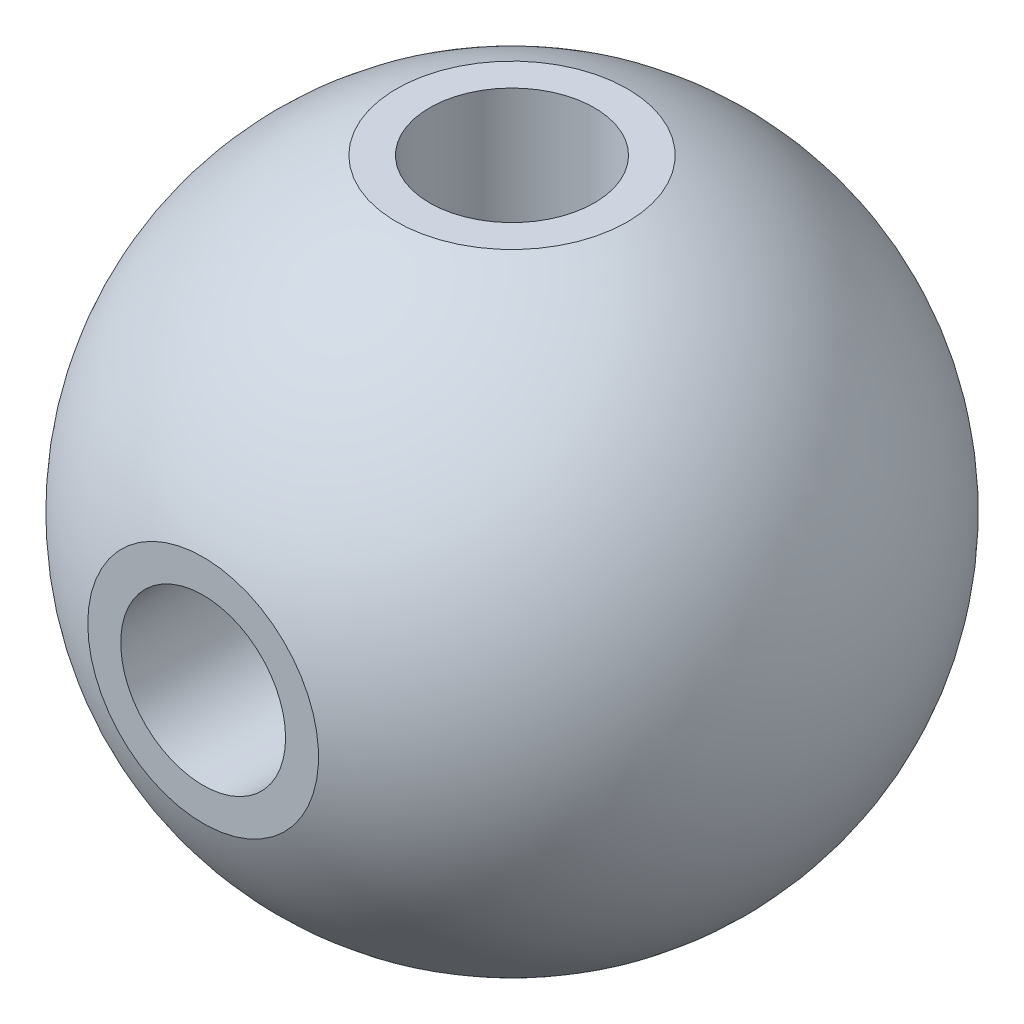
from build123d import *

# Parameters (mm, degrees)
CUT_EXTRUDE1_START = 11.896721
SKETCH3_R          = 4.445
CUT_EXTRUDE1_DEPTH = 2.54
SKETCH4_R          = 3.175
CUT_EXTRUDE2_DEPTH = 7.62
CUT_EXTRUDE3_START = 11.896721
SKETCH5_R          = 4.445
CUT_EXTRUDE3_DEPTH = 7.62
SKETCH6_R          = 3.175
CUT_EXTRUDE4_DEPTH = 7.62


with BuildPart() as part:
    # Sketch2 → Revolve2 (revolve)
    with BuildSketch(Plane.XY):
        with BuildLine():
            Line((0, 12.7), (0, -12.7))
            ThreePointArc((0, -12.7), (12.7, 0), (0, 12.7))
        make_face()
    revolve(axis=Axis((0, 0, 0), (0, 1, 0)))

    # Sketch3 → Cut-Extrude1 (cut)
    with BuildSketch(Plane.XY.offset(CUT_EXTRUDE1_START)):
        Circle(SKETCH3_R)
    cut_extrude1 = extrude(amount=CUT_EXTRUDE1_DEPTH, mode=Mode.SUBTRACT)

    # Sketch4 → Cut-Extrude2 (cut)
    with BuildSketch(Plane.XY.offset(11.896721187)):
        Circle(SKETCH4_R)
    cut_extrude2 = extrude(amount=-CUT_EXTRUDE2_DEPTH, mode=Mode.SUBTRACT)

    # Mirror1: Cut-Extrude1, Cut-Extrude2 across plane
    add(cut_extrude1.mirror(Plane.XY), mode=Mode.SUBTRACT)
    add(cut_extrude2.mirror(Plane.XY), mode=Mode.SUBTRACT)

    # Sketch5 → Cut-Extrude3 (cut)
    with BuildSketch(Plane(origin=(0, 0, 0), x_dir=(1, 0, 0), z_dir=(0, 1, 0)).offset(CUT_EXTRUDE3_START)):
        Circle(SKETCH5_R)
    extrude(amount=CUT_EXTRUDE3_DEPTH, mode=Mode.SUBTRACT)

    # Sketch6 → Cut-Extrude4 (cut)
    with BuildSketch(Plane(origin=(0, 11.896721187, 0), x_dir=(1, 0, 0), z_dir=(0, 1, 0))):
        with Locations(Location((0, 0, 0), (0, 0, 270))):
            Circle(SKETCH6_R)
    extrude(amount=-CUT_EXTRUDE4_DEPTH, mode=Mode.SUBTRACT)


solid = part.part
